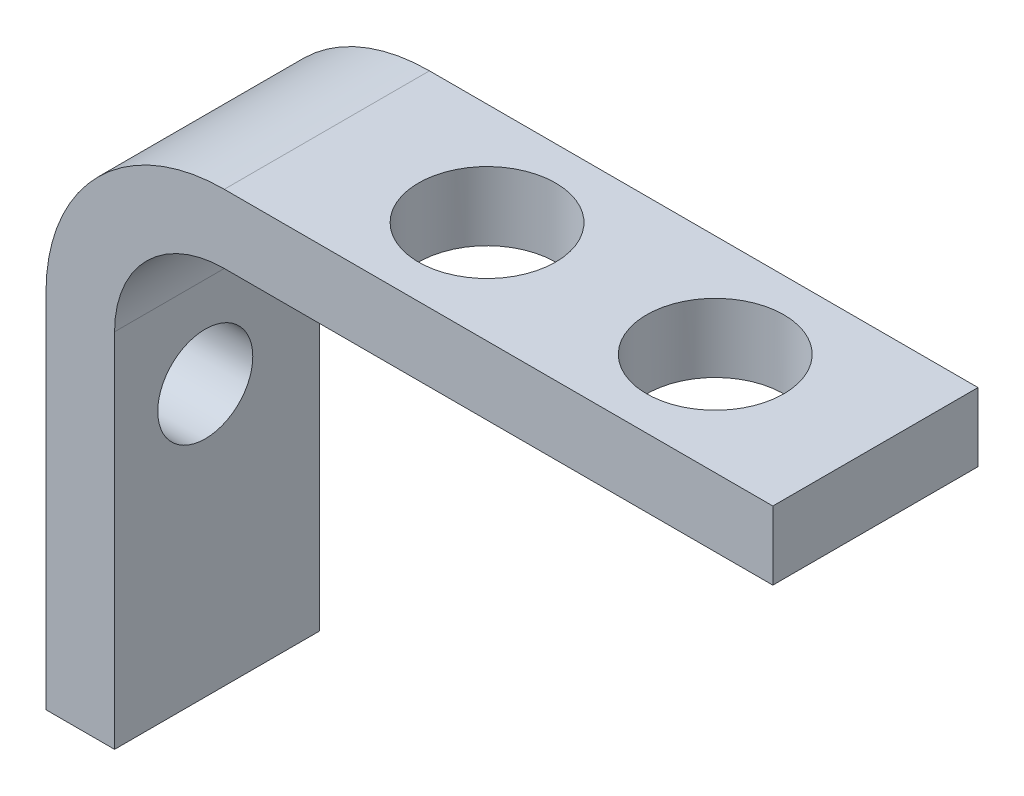
from build123d import *

# Parameters (mm, degrees)
BOSS_EXTRUDE1_DEPTH = 4.75
SKETCH2_R           = 1.1
CUT_EXTRUDE1_DEPTH  = 1.5875
CUT_EXTRUDE2_DEPTH  = 2.54


with BuildPart() as part:
    # Sketch1 → Boss-Extrude1 (new body)
    with BuildSketch(Plane.XY):
        with BuildLine():
            Line((0, 0), (0, 8.3725))
            ThreePointArc((0, 8.3725), (0.743948776, 10.168551224), (2.54, 10.9125))
            Line((2.54, 10.9125), (15.24, 10.9125))
            Line((15.24, 10.9125), (15.24, 12.5))
            Line((15.24, 12.5), (2.54, 12.5))
            ThreePointArc((2.54, 12.5), (-0.378583239, 11.291083239), (-1.5875, 8.3725))
            Line((-1.5875, 8.3725), (-1.5875, 0))
            Line((-1.5875, 0), (0, 0))
        make_face()
    extrude(amount=BOSS_EXTRUDE1_DEPTH)

    # Sketch2 → Cut-Extrude1 (cut)
    with BuildSketch(Plane(origin=(0, 0, 0), x_dir=(0, 0, -1), z_dir=(1, 0, 0))):
        with Locations((-2.65, 6.277)):
            Circle(SKETCH2_R)
    extrude(amount=-CUT_EXTRUDE1_DEPTH, mode=Mode.SUBTRACT)

    # Sketch3 → Cut-Extrude2 (cut)
    with BuildSketch(Plane.XZ.offset(-10.9125)):
        with BuildLine():
            ThreePointArc((4.6609, 2.375), (6.2484, 0.7875), (7.8359, 2.375))
            Line((7.8359, 2.375), (4.6609, 2.375))
        make_face()
        with BuildLine():
            Line((4.6609, 2.375), (7.8359, 2.375))
            ThreePointArc((7.8359, 2.375), (6.2484, 3.9625), (4.6609, 2.375))
        make_face()
        with BuildLine():
            ThreePointArc((9.9441, 2.375), (11.5316, 0.7875), (13.1191, 2.375))
            Line((13.1191, 2.375), (9.9441, 2.375))
        make_face()
        with BuildLine():
            Line((9.9441, 2.375), (13.1191, 2.375))
            ThreePointArc((13.1191, 2.375), (11.5316, 3.9625), (9.9441, 2.375))
        make_face()
    extrude(amount=-CUT_EXTRUDE2_DEPTH, mode=Mode.SUBTRACT)


solid = part.part
